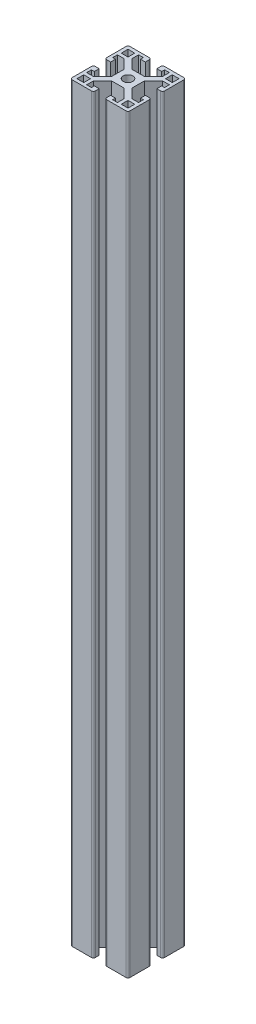
from build123d import *

# Parameters (mm, degrees)
SKETCH1_R           = 2.5
SKETCH1_W           = 3.5
SKETCH1_H           = 3.5
BOSS_EXTRUDE1_DEPTH = 390
FILLET1_R           = 1


with BuildPart() as part:
    # Sketch1 → Boss-Extrude1 (new body)
    with BuildSketch(Plane(origin=(0, 0, 0), x_dir=(1, 0, 0), z_dir=(0, 1, 0))):
        Polygon((-15, 7.5), (-15, -4.5), (-12, -4.5), (-12, -2), (-13.5, -2), (-13.5, 0.5), (-10, 0.5), (-5.25, -4.25), (-5.25, -10.75), (-10, -15.5), (-13.5, -15.5), (-13.5, -13), (-12, -13), (-12, -10.5), (-15, -10.5), (-15, -22.5), (-3, -22.5), (-3, -19.5), (-5.5, -19.5), (-5.5, -21), (-8, -21), (-8, -17.5), (-3.25, -12.75), (3.25, -12.75), (8, -17.5), (8, -21), (5.5, -21), (5.5, -19.5), (3, -19.5), (3, -22.5), (15, -22.5), (15, -10.5), (12, -10.5), (12, -13), (13.5, -13), (13.5, -15.5), (10, -15.5), (5.25, -10.75), (5.25, -4.25), (10, 0.5), (13.5, 0.5), (13.5, -2), (12, -2), (12, -4.5), (15, -4.5), (15, 7.5), (3, 7.5), (3, 4.5), (5.5, 4.5), (5.5, 6), (8, 6), (8, 2.5), (3.25, -2.25), (-3.25, -2.25), (-8, 2.5), (-8, 6), (-5.5, 6), (-5.5, 4.5), (-3, 4.5), (-3, 7.5), align=None)
        with Locations(Location((0, -7.5, 0), (0, 0, 270))):
            Circle(SKETCH1_R, mode=Mode.SUBTRACT)
        with Locations((-11.5, 4)):
            Rectangle(SKETCH1_W, SKETCH1_H, mode=Mode.SUBTRACT)
        with Locations((11.5, 4)):
            Rectangle(SKETCH1_W, SKETCH1_H, mode=Mode.SUBTRACT)
        with Locations((11.5, -19)):
            Rectangle(SKETCH1_W, SKETCH1_H, mode=Mode.SUBTRACT)
        with Locations((-11.5, -19)):
            Rectangle(SKETCH1_W, SKETCH1_H, mode=Mode.SUBTRACT)
    extrude(amount=-BOSS_EXTRUDE1_DEPTH)

    # Fillet1
    fillet1_edges = [part.edges().sort_by_distance(p)[0] for p in [
        (15, -195, 10.5),
        (15, -195, 22.5),
        (3, -195, 22.5),
        (-3, -195, 22.5),
        (-15, -195, 22.5),
        (-15, -195, 10.5),
        (-15, -195, 4.5),
        (-15, -195, -7.5),
        (-3, -195, -7.5),
        (3, -195, -7.5),
        (15, -195, -7.5),
        (15, -195, 4.5),
    ]]
    fillet(fillet1_edges, radius=FILLET1_R)


solid = part.part
